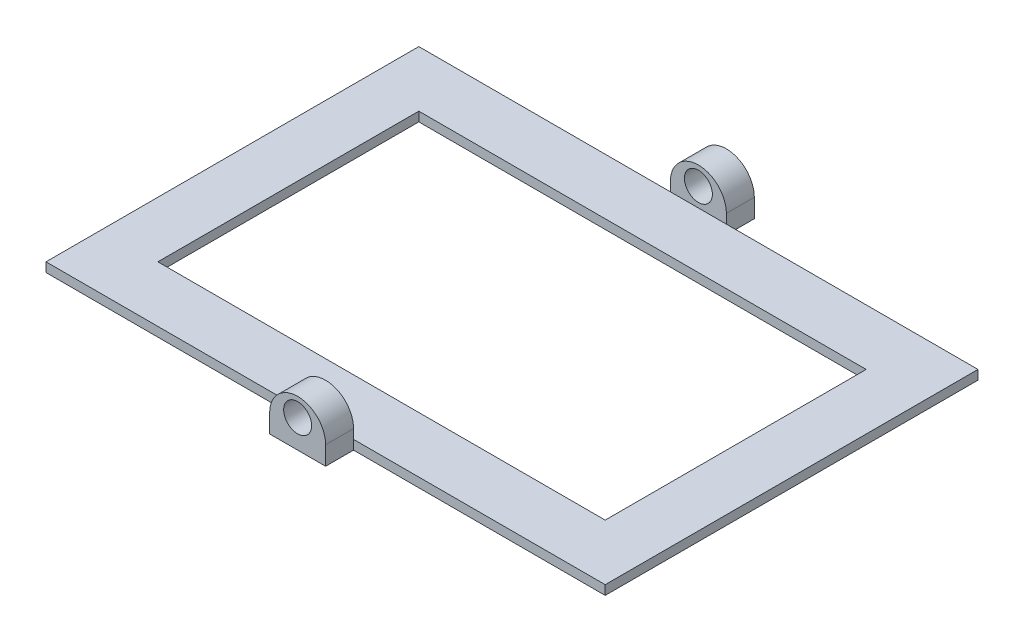
from build123d import *

# Parameters (mm, degrees)
SKETCH1_W           = 300
SKETCH1_H           = 200
SKETCH1_W_2         = 240
SKETCH1_H_2         = 140
BOSS_EXTRUDE1_DEPTH = 5
SKETCH3_R           = 7.5
BOSS_EXTRUDE2_DEPTH = 15


with BuildPart() as part:
    # Sketch1 → Boss-Extrude1 (new body)
    with BuildSketch(Plane(origin=(0, 0, 0), x_dir=(1, 0, 0), z_dir=(0, 1, 0))):
        with Locations((-85.116384968, -68.067851076)):
            Rectangle(SKETCH1_W, SKETCH1_H)
        with Locations((-85.116384968, -68.067851076)):
            Rectangle(SKETCH1_W_2, SKETCH1_H_2, mode=Mode.SUBTRACT)
    extrude(amount=BOSS_EXTRUDE1_DEPTH)

    # Sketch3 → Boss-Extrude2 (add)
    with BuildSketch(Plane.XY.offset(168.067851076)):
        with BuildLine():
            Line((-100.116384968, 0), (-70.116384968, 0))
            Line((-70.116384968, 0), (-70.116384968, 10))
            ThreePointArc((-70.116384968, 10), (-85.116384968, 25), (-100.116384968, 10))
            Line((-100.116384968, 10), (-100.116384968, 0))
        make_face()
        with Locations((-85.116384968, 15.071690081)):
            Circle(SKETCH3_R, mode=Mode.SUBTRACT)
    boss_extrude2 = extrude(amount=BOSS_EXTRUDE2_DEPTH)

    # Mirror1: Boss-Extrude2 across plane
    add(boss_extrude2.mirror(Plane.XY.offset(68.067851076)))


solid = part.part
